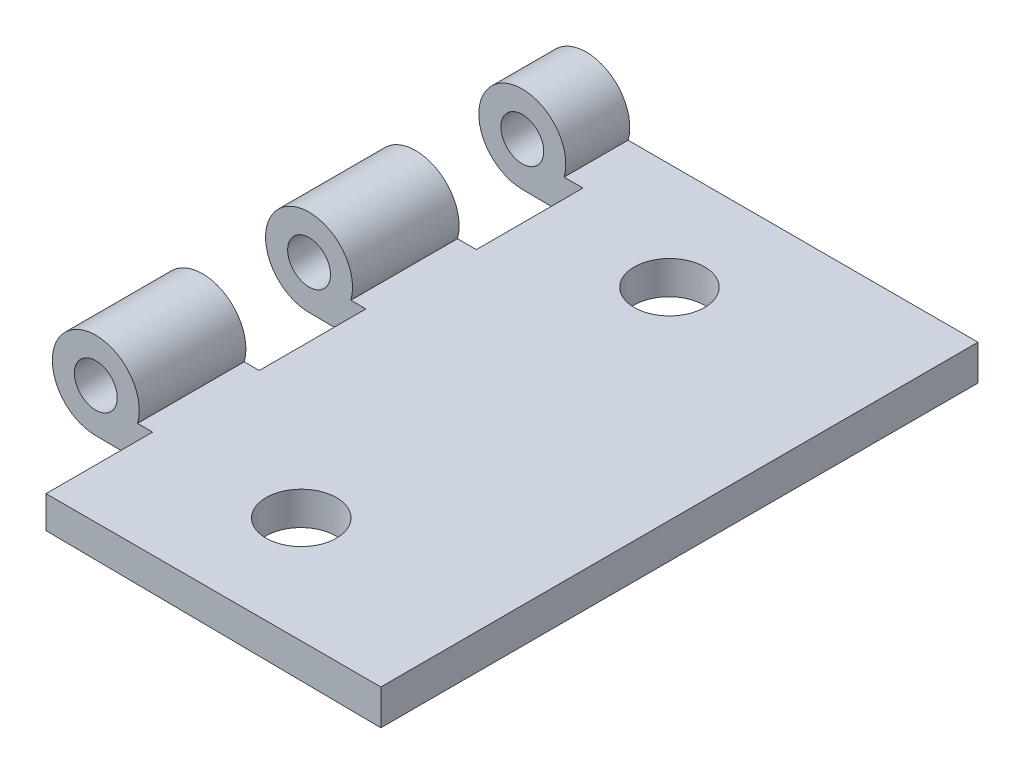
from build123d import *

# Parameters (mm, degrees)
SKETCH_25_R              = 10.043747569
EXTRUDE_13_DEPTH         = 280
SKETCH_26_R              = 16.505129475
CUT_EXTRUDE_3_DEPTH      = 336.875889274
CUT_EXTRUDE_4_DEPTH      = 336.875889274
CUT_EXTRUDE_4_DEPTH_BACK = 336.875889274
SKETCH_27_W              = 70.665536313
SKETCH_27_H              = 50
SKETCH_27_W_2            = 68.866777207


with BuildPart() as part:
    # 草图25 → 凸台-拉伸13 (new body)
    with BuildSketch(Plane.XY):
        with BuildLine():
            Line((0, -20.387033345), (183.674687946, -22.201454999))
            Line((183.674687946, -22.201454999), (183.674687946, -5.617235602))
            Line((183.674687946, -5.617235602), (19.597902766, -5.617235602))
            ThreePointArc((19.597902766, -5.617235602), (-12.27013364, 16.281122476), (0, -20.387033345))
        make_face()
        Circle(SKETCH_25_R, mode=Mode.SUBTRACT)
    extrude(amount=EXTRUDE_13_DEPTH)

    # 草图26 → 切除-拉伸3 (cut, through all)
    with BuildSketch(Plane(origin=(0, -5.617235602, 0), x_dir=(1, 0, 0), z_dir=(0, 1, 0))):
        with Locations(Location((88.997396182, -50, 0), (0, 0, 270))):
            Circle(SKETCH_26_R)
        with Locations(Location((96.350965064, -230, 0), (0, 0, 270))):
            Circle(SKETCH_26_R)
    extrude(amount=-CUT_EXTRUDE_3_DEPTH, mode=Mode.SUBTRACT)

    # 草图27 → 切除-拉伸4 (cut, two sides: drawn at the far end of the back side and taken through both)
    with BuildSketch(Plane(origin=(0, -5.617235602, 0), x_dir=(1, 0, 0), z_dir=(0, 1, 0)).offset(-CUT_EXTRUDE_4_DEPTH_BACK)):
        with Locations((-6.880817282, -55)):
            Rectangle(SKETCH_27_W, SKETCH_27_H)
        with Locations((-7.780196834, -155)):
            Rectangle(SKETCH_27_W_2, SKETCH_27_H)
        with Locations((-7.780196834, -255)):
            Rectangle(SKETCH_27_W_2, SKETCH_27_H)
    extrude(amount=CUT_EXTRUDE_4_DEPTH + CUT_EXTRUDE_4_DEPTH_BACK, mode=Mode.SUBTRACT)


solid = part.part
